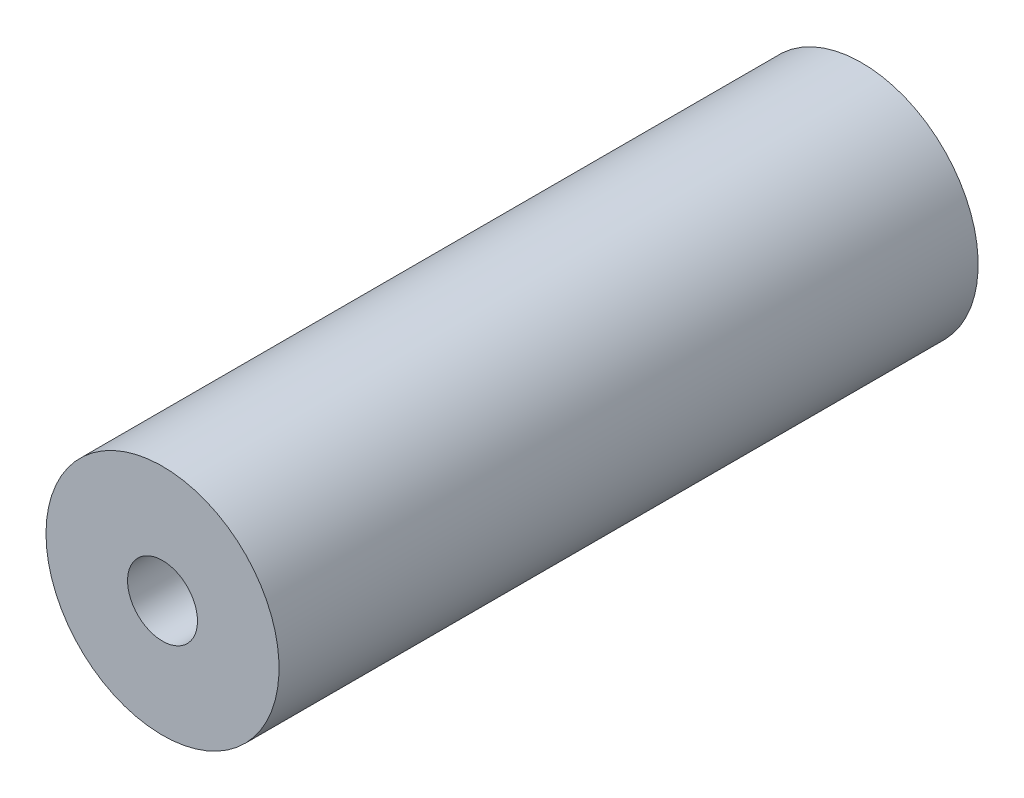
from build123d import *

# Parameters (mm, degrees)
SKETCH2_R           = 3.5
BOSS_EXTRUDE1_DEPTH = 21
SKETCH7_R           = 1.05
CUT_EXTRUDE2_DEPTH  = 6
SKETCH4_W           = 4.65
SKETCH4_H           = 4.65
CUT_EXTRUDE5_DEPTH  = 10.2


with BuildPart() as part:
    # Sketch2 → Boss-Extrude1 (new body)
    with BuildSketch(Plane.XY):
        with Locations(Location((0, 0, 0), (0, 0, 180))):
            Circle(SKETCH2_R)
    extrude(amount=BOSS_EXTRUDE1_DEPTH)

    # Sketch7 → Cut-Extrude2 (cut)
    with BuildSketch(Plane.XY.offset(21)):
        Circle(SKETCH7_R)
    extrude(amount=-CUT_EXTRUDE2_DEPTH, mode=Mode.SUBTRACT)

    # Sketch4 → Cut-Extrude5 (cut)
    with BuildSketch(Plane(origin=(0, 0, 0), x_dir=(-1, 0, 0), z_dir=(0, 0, -1))):
        Rectangle(SKETCH4_W, SKETCH4_H)
    extrude(amount=-CUT_EXTRUDE5_DEPTH, mode=Mode.SUBTRACT)


solid = part.part
